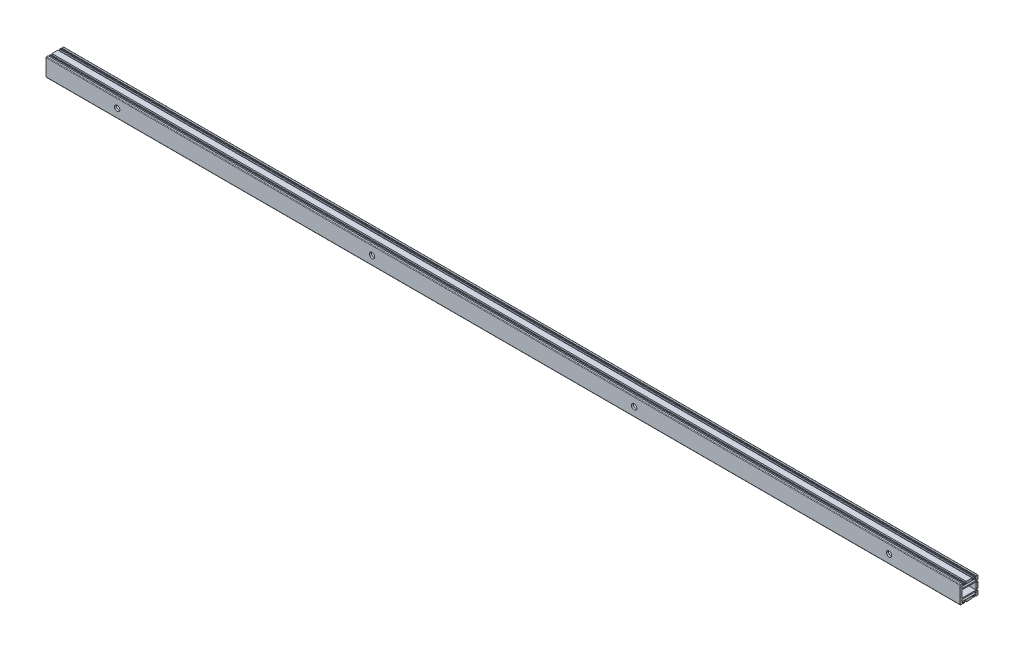
from build123d import *

# Parameters (mm, degrees)
SKETCH_1_W             = 23.5
SKETCH_1_H             = 12
EXTRUDE_1_DEPTH        = 771
HOLE_WIZARD_M6_1_D     = 5
HOLE_WIZARD_M6_1_DEPTH = 15
HOLE_WIZARD_M6_1_TIP   = 1.502151548
HOLE_WIZARD_M6_2_D     = 5
HOLE_WIZARD_M6_2_DEPTH = 15
HOLE_WIZARD_M6_2_TIP   = 1.502151548
SKETCH_7_R             = 4.5
CUT_EXTRUDE_1_DEPTH    = 772.729227126
HOLE_WIZARD_M4_1_D     = 3.3
HOLE_WIZARD_M4_1_DEPTH = 10.1
HOLE_WIZARD_M4_1_TIP   = 0.991420021


with BuildPart() as part:
    # 草图1 → 凸台-拉伸1 (new, symmetric)
    with BuildSketch(Plane(origin=(0, 0, 0), x_dir=(0, 0, -1), z_dir=(1, 0, 0))):
        with BuildLine():
            Line((-14, 15), (-11.5, 15))
            Line((-11.5, 15), (-11.5, 13.5))
            Line((-11.5, 13.5), (-11.4, 13.5))
            ThreePointArc((-11.4, 13.5), (-11.117157288, 13.382842712), (-11, 13.1))
            Line((-11, 13.1), (-11, 12))
            Line((-11, 12), (-9.5, 12))
            Line((-9.5, 12), (-9.5, 15))
            Line((-9.5, 15), (-8, 15))
            Line((-8, 15), (-8, 12.5))
            Line((-8, 12.5), (-5, 12.5))
            Line((-5, 12.5), (-5, 15))
            Line((-5, 15), (5, 15))
            Line((5, 15), (5, 12.5))
            Line((5, 12.5), (8, 12.5))
            Line((8, 12.5), (8, 15))
            Line((8, 15), (9.5, 15))
            Line((9.5, 15), (9.5, 12))
            Line((9.5, 12), (11, 12))
            Line((11, 12), (11, 13.1))
            ThreePointArc((11, 13.1), (11.117157288, 13.382842712), (11.4, 13.5))
            Line((11.4, 13.5), (11.5, 13.5))
            Line((11.5, 13.5), (11.5, 15))
            Line((11.5, 15), (14, 15))
            ThreePointArc((14, 15), (14.707106781, 14.707106781), (15, 14))
            Line((15, 14), (15, 8))
            Line((15, 8), (12.5, 8))
            Line((12.5, 8), (12.5, 5))
            Line((12.5, 5), (15, 5))
            Line((15, 5), (15, -5))
            Line((15, -5), (12.5, -5))
            Line((12.5, -5), (12.5, -8))
            Line((12.5, -8), (15, -8))
            Line((15, -8), (15, -14))
            ThreePointArc((15, -14), (14.707106781, -14.707106781), (14, -15))
            Line((14, -15), (11.5, -15))
            Line((11.5, -15), (11.5, -13.5))
            Line((11.5, -13.5), (11.4, -13.5))
            ThreePointArc((11.4, -13.5), (11.117157288, -13.382842712), (11, -13.1))
            Line((11, -13.1), (11, -12))
            Line((11, -12), (9.5, -12))
            Line((9.5, -12), (9.5, -15))
            Line((9.5, -15), (8, -15))
            Line((8, -15), (8, -12.5))
            Line((8, -12.5), (5, -12.5))
            Line((5, -12.5), (5, -15))
            Line((5, -15), (-5, -15))
            Line((-5, -15), (-5, -12.5))
            Line((-5, -12.5), (-8, -12.5))
            Line((-8, -12.5), (-8, -15))
            Line((-8, -15), (-9.5, -15))
            Line((-9.5, -15), (-9.5, -12))
            Line((-9.5, -12), (-11, -12))
            Line((-11, -12), (-11, -13.1))
            ThreePointArc((-11, -13.1), (-11.117157288, -13.382842712), (-11.4, -13.5))
            Line((-11.4, -13.5), (-11.5, -13.5))
            Line((-11.5, -13.5), (-11.5, -15))
            Line((-11.5, -15), (-14, -15))
            ThreePointArc((-14, -15), (-14.707106781, -14.707106781), (-15, -14))
            Line((-15, -14), (-15, 14))
            ThreePointArc((-15, 14), (-14.707106781, 14.707106781), (-14, 15))
        make_face()
        with BuildLine():
            Line((12, -10.5), (12, -8.5))
            ThreePointArc((12, -8.5), (11.853553391, -8.146446609), (11.5, -8))
            Line((11.5, -8), (-11.5, -8))
            ThreePointArc((-11.5, -8), (-11.853553391, -8.146446609), (-12, -8.5))
            Line((-12, -8.5), (-12, -10.5))
            ThreePointArc((-12, -10.5), (-11.853553391, -10.853553391), (-11.5, -11))
            Line((-11.5, -11), (11.5, -11))
            ThreePointArc((11.5, -11), (11.853553391, -10.853553391), (12, -10.5))
        make_face(mode=Mode.SUBTRACT)
        with BuildLine():
            Line((-11.5, 11), (11.5, 11))
            ThreePointArc((11.5, 11), (11.853553391, 10.853553391), (12, 10.5))
            Line((12, 10.5), (12, 8.5))
            ThreePointArc((12, 8.5), (11.853553391, 8.146446609), (11.5, 8))
            Line((11.5, 8), (-11.5, 8))
            ThreePointArc((-11.5, 8), (-11.853553391, 8.146446609), (-12, 8.5))
            Line((-12, 8.5), (-12, 10.5))
            ThreePointArc((-12, 10.5), (-11.853553391, 10.853553391), (-11.5, 11))
        make_face(mode=Mode.SUBTRACT)
        Rectangle(SKETCH_1_W, SKETCH_1_H, mode=Mode.SUBTRACT)
    extrude(amount=EXTRUDE_1_DEPTH, both=True)

    # M6 螺纹孔1
    with Locations(Plane(origin=(0, 0, -15), x_dir=(-1, 0, 0), z_dir=(0, 0, -1))):
        with Locations((751, 0), (736, 0), (566, 0), (551, 0), (481, 0), (466, 0), (-466, 0), (-481, 0), (-551, 0), (-566, 0), (-736, 0), (-751, 0)):
            Hole(HOLE_WIZARD_M6_1_D / 2, depth=HOLE_WIZARD_M6_1_DEPTH)
            with Locations((0, 0, -(HOLE_WIZARD_M6_1_DEPTH + HOLE_WIZARD_M6_1_TIP / 2))):  # 118° drill point
                Cone(0, HOLE_WIZARD_M6_1_D / 2, HOLE_WIZARD_M6_1_TIP, mode=Mode.SUBTRACT)

    # M6 螺纹孔2
    with Locations(Plane.XZ.offset(15)):
        with Locations((751, 0), (736, 0), (-736, 0), (-751, 0)):
            Hole(HOLE_WIZARD_M6_2_D / 2, depth=HOLE_WIZARD_M6_2_DEPTH)
            with Locations((0, 0, -(HOLE_WIZARD_M6_2_DEPTH + HOLE_WIZARD_M6_2_TIP / 2))):  # 118° drill point
                Cone(0, HOLE_WIZARD_M6_2_D / 2, HOLE_WIZARD_M6_2_TIP, mode=Mode.SUBTRACT)

    # 草图7 → 切除-拉伸1 (cut, through all)
    with BuildSketch(Plane.XY.offset(15)):
        with Locations((-651, 0)):
            Circle(SKETCH_7_R)
        with Locations((-221, 0)):
            Circle(SKETCH_7_R)
        with Locations((651, 0)):
            Circle(SKETCH_7_R)
        with Locations((221, 0)):
            Circle(SKETCH_7_R)
    extrude(amount=-CUT_EXTRUDE_1_DEPTH, mode=Mode.SUBTRACT)

    # M4 螺纹孔1
    with Locations(Plane.XZ.offset(15)):
        with Locations((-151, 0), (-133, 0), (133, 0), (151, 0)):
            Hole(HOLE_WIZARD_M4_1_D / 2, depth=HOLE_WIZARD_M4_1_DEPTH)
            with Locations((0, 0, -(HOLE_WIZARD_M4_1_DEPTH + HOLE_WIZARD_M4_1_TIP / 2))):  # 118° drill point
                Cone(0, HOLE_WIZARD_M4_1_D / 2, HOLE_WIZARD_M4_1_TIP, mode=Mode.SUBTRACT)


solid = part.part
